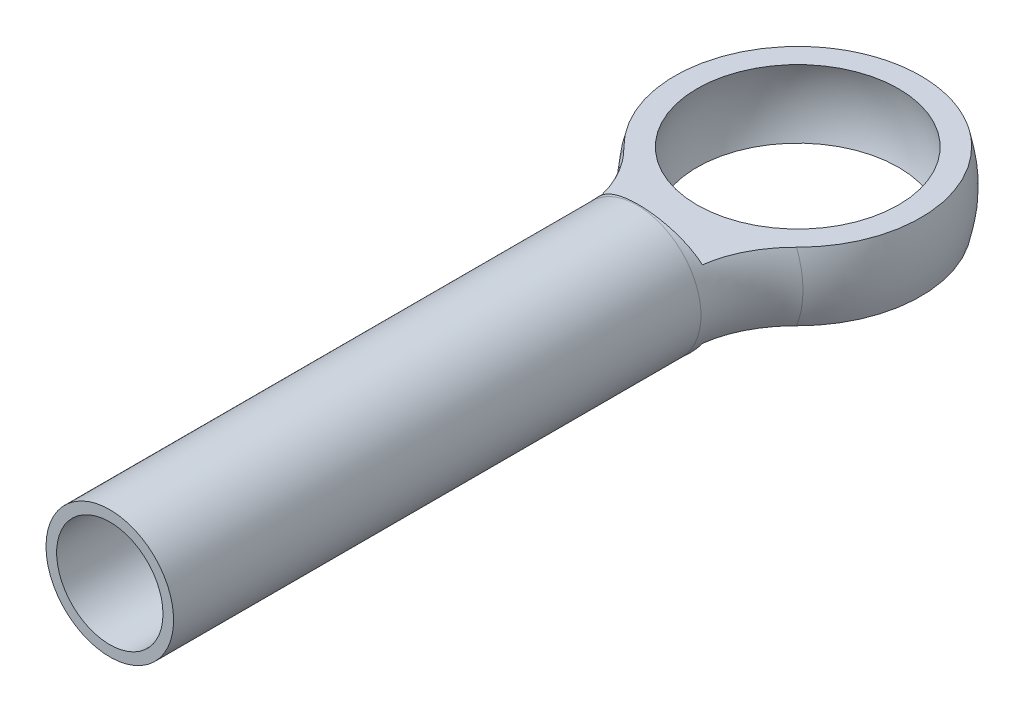
from build123d import *

# Parameters (mm, degrees)
SHELL1_T           = -1.27
SKETCH2_R          = 1.5875
CUT_EXTRUDE2_DEPTH = 6.35
SKETCH3_R          = 4.7625
CUT_EXTRUDE3_DEPTH = 3.81


with BuildPart() as part:
    # Sketch1 → Revolve1 (revolve)
    with BuildSketch(Plane(origin=(0, 0, 0), x_dir=(1, 0, 0), z_dir=(0, 1, 0))):
        with BuildLine():
            Line((-1.905, -4.794144866), (-1.905, -20.542144866))
            Line((-1.905, -20.542144866), (0, -20.542144866))
            Line((0, -20.542144866), (0, 3.81))
            ThreePointArc((0, 3.81), (-3.498514306, 1.508806698), (-2.770909091, -2.614988109))
            ThreePointArc((-2.770909091, -2.614988109), (-2.129407802, -3.621698415), (-1.905, -4.794144866))
        make_face()
    revolve(axis=Axis((0, 0, -3.81), (0, 0, 1)))

    # Shell1
    shell1_openings = [part.faces().sort_by_distance(p)[0] for p in [
        (0, 0, 20.542144866),
    ]]
    offset(amount=SHELL1_T, openings=shell1_openings, kind=Kind.INTERSECTION)

    # Sketch4 → Cut-Revolve1 (revolve, cut)
    with BuildSketch(Plane(origin=(0, 0, 0), x_dir=(0, 0, -1), z_dir=(1, 0, 0))):
        with BuildLine():
            Line((0, 3.175), (0, -3.175))
            ThreePointArc((0, -3.175), (3.175, 0), (0, 3.175))
        make_face()
    revolve(axis=Axis((0, 3.175, 0), (0, -1, 0)), mode=Mode.SUBTRACT)

    # Sketch2 → Cut-Extrude2 (cut)
    with BuildSketch(Plane.XY.offset(20.542144866)):
        Circle(SKETCH2_R)
    extrude(amount=-CUT_EXTRUDE2_DEPTH, mode=Mode.SUBTRACT)

    # Sketch3 → Cut-Extrude3 (cut)
    with BuildSketch(Plane(origin=(0, 1.016, 0), x_dir=(1, 0, 0), z_dir=(0, 1, 0))):
        Circle(SKETCH3_R)
    cut_extrude3 = extrude(amount=CUT_EXTRUDE3_DEPTH, mode=Mode.SUBTRACT)

    # Mirror1: Cut-Extrude3 across plane
    add(cut_extrude3.mirror(Plane.ZX), mode=Mode.SUBTRACT)


solid = part.part
